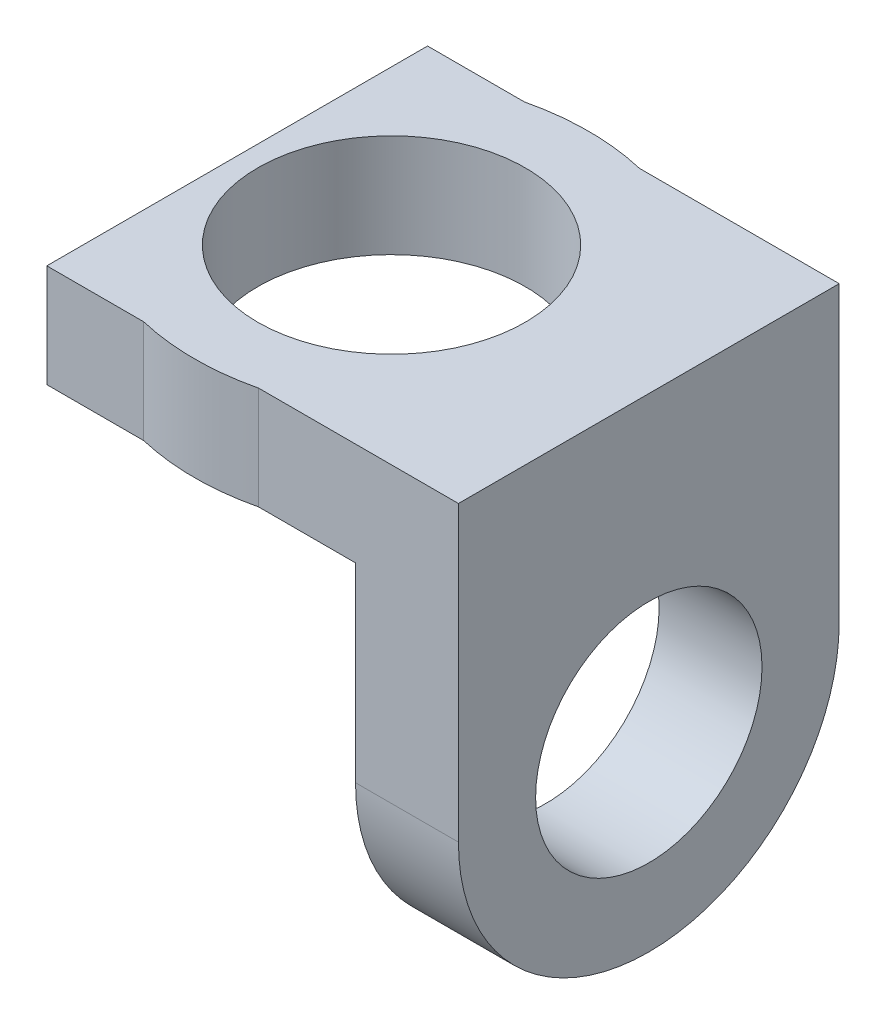
from build123d import *

# Parameters (mm, degrees)
SKETCH1_R           = 18.5
SKETCH1_R_2         = 11
BOSS_EXTRUDE1_DEPTH = 10
BOSS_EXTRUDE2_REACH = 44.559
SKETCH2_W           = 10
SKETCH2_H           = 37
SKETCH2_3_R         = 13
BOSS_EXTRUDE3_DEPTH = 10


with BuildPart() as part:
    # Sketch1 → Boss-Extrude1 (new body)
    with BuildSketch(Plane(origin=(0, 0, 0), x_dir=(0, 0, -1), z_dir=(1, 0, 0))):
        Circle(SKETCH1_R)
        Circle(SKETCH1_R_2, mode=Mode.SUBTRACT)
    extrude(amount=BOSS_EXTRUDE1_DEPTH)

    # Sketch2 → Boss-Extrude2 (add, up to next)
    with BuildSketch(Plane(origin=(0, 18.5, 0), x_dir=(1, 0, 0), z_dir=(0, 1, 0)), mode=Mode.PRIVATE) as boss_extrude2_sk1:
        with Locations((5, 0)):
            Rectangle(SKETCH2_W, SKETCH2_H)
    boss_extrude2_tool1 = extrude(boss_extrude2_sk1.sketch, amount=-BOSS_EXTRUDE2_REACH, mode=Mode.PRIVATE) - part.part
    add(boss_extrude2_tool1.solids().sort_by_distance((5, 18.5, 0))[0])
    add(boss_extrude2_tool1.solids().sort_by_distance((5, 18.5, 0))[1])

    # Sketch2<3> → Boss-Extrude3 (add)
    with BuildSketch(Plane(origin=(0, 18.5, 0), x_dir=(1, 0, 0), z_dir=(0, 1, 0))):
        with BuildLine():
            Line((10, -18.5), (10, 18.5))
            Line((10, 18.5), (-9.411981237, 18.5))
            ThreePointArc((-9.411981237, 18.5), (-15, 19.153967532), (-20.588018763, 18.5))
            Line((-20.588018763, 18.5), (-30, 18.5))
            Line((-30, 18.5), (-30, -18.5))
            Line((-30, -18.5), (-20.588018763, -18.5))
            ThreePointArc((-20.588018763, -18.5), (-15, -19.153967532), (-9.411981237, -18.5))
            Line((-9.411981237, -18.5), (10, -18.5))
        make_face()
        with Locations(Location((-15, 0, 0), (0, 0, 270))):
            Circle(SKETCH2_3_R, mode=Mode.SUBTRACT)
    extrude(amount=BOSS_EXTRUDE3_DEPTH)


solid = part.part
